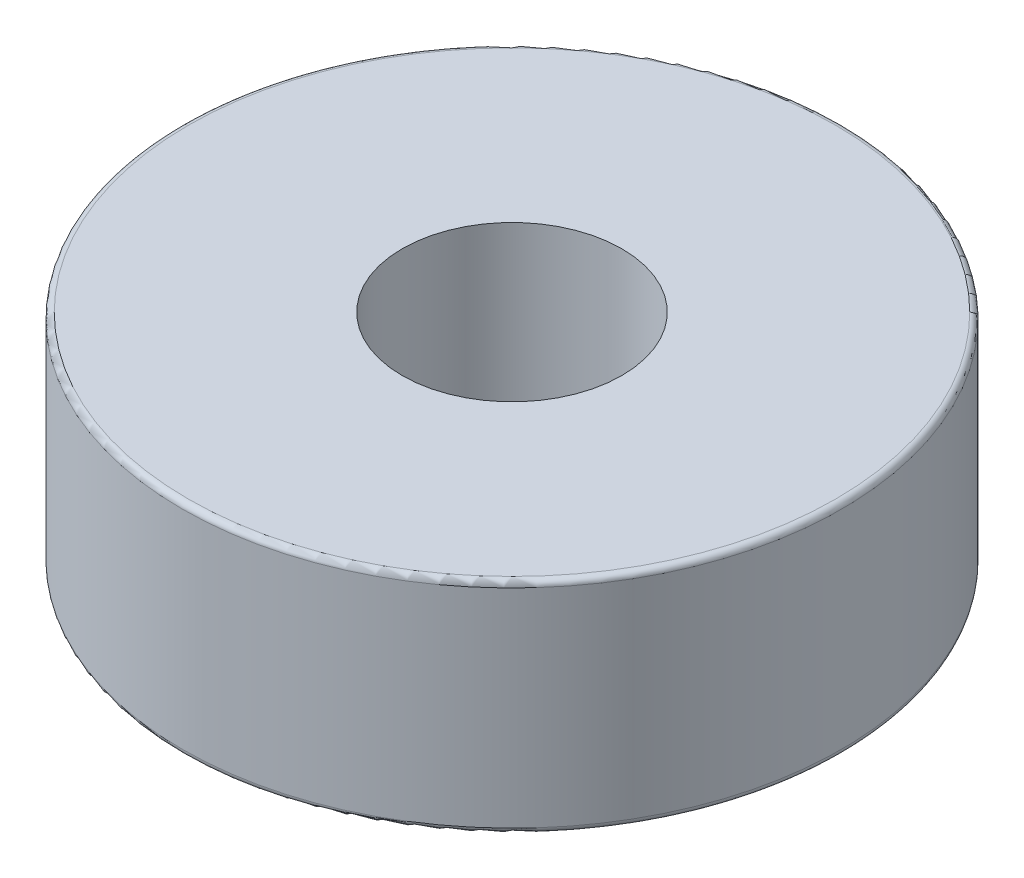
from build123d import *

# Parameters (mm, degrees)
SKETCH1_R           = 14.2875
SKETCH1_R_2         = 4.7625
BOSS_EXTRUDE1_DEPTH = 9.525
FILLET1_R           = 0.254


with BuildPart() as part:
    # Sketch1 → Boss-Extrude1 (new body)
    with BuildSketch(Plane.XZ):
        with Locations(Location((0, 0, 0), (0, 0, 270))):
            Circle(SKETCH1_R)
        with Locations(Location((0, 0, 0), (0, 0, 270))):
            Circle(SKETCH1_R_2, mode=Mode.SUBTRACT)
    extrude(amount=-BOSS_EXTRUDE1_DEPTH)

    # Fillet1
    fillet1_edges = [part.edges().sort_by_distance(p)[0] for p in [
        (0, 0, 14.2875),
        (0, 9.525, 14.2875),
    ]]
    fillet(fillet1_edges, radius=FILLET1_R)


solid = part.part
